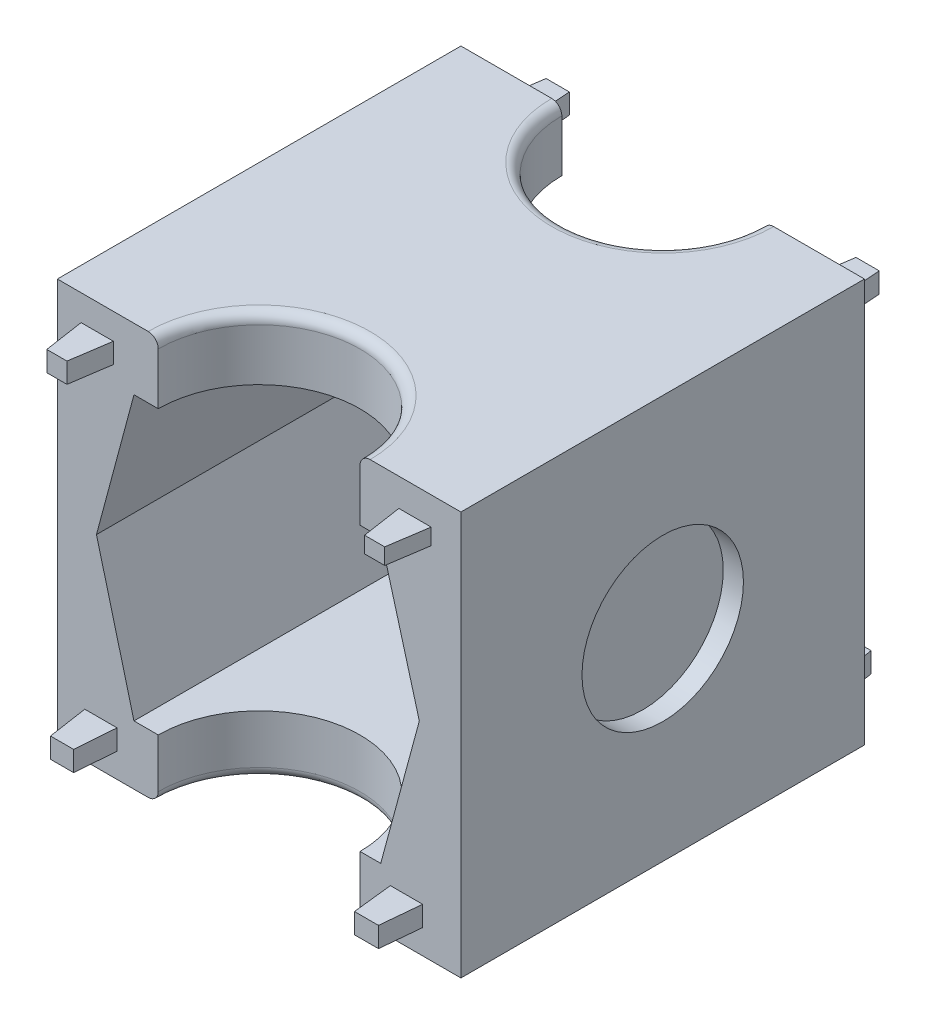
from build123d import *

# Parameters (mm, degrees)
SKETCH1_W               = 100
SKETCH1_H               = 100
BOSS_EXTRUDE1_DEPTH     = 100
SKETCH2_R               = 20
CUT_EXTRUDE1_DEPTH      = 5
CUT_EXTRUDE2_START      = -5
SKETCH3_R               = 20
CUT_EXTRUDE2_DEPTH      = 5
CUT_EXTRUDE3_DEPTH      = 151
CUT_EXTRUDE5_DEPTH      = 151
CUT_EXTRUDE5_DEPTH_BACK = 151
CUT_EXTRUDE6_DEPTH      = 151
CUT_EXTRUDE6_DEPTH_BACK = 151
FILLET3_R               = 2.5
BOSS_EXTRUDE3_DEPTH     = 10
CUT_EXTRUDE8_DEPTH      = 10
CUT_EXTRUDE9_DEPTH      = 10
BOSS_EXTRUDE4_DEPTH     = 10
CUT_EXTRUDE11_DEPTH     = 10
CUT_EXTRUDE12_DEPTH     = 10
BOSS_EXTRUDE5_DEPTH     = 10
CUT_EXTRUDE13_DEPTH     = 10
CUT_EXTRUDE15_DEPTH     = 10
BOSS_EXTRUDE6_DEPTH     = 10
CUT_EXTRUDE16_DEPTH     = 10
CUT_EXTRUDE17_DEPTH     = 10
BOSS_EXTRUDE7_DEPTH     = 10
CUT_EXTRUDE18_DEPTH     = 10
CUT_EXTRUDE19_DEPTH     = 10
BOSS_EXTRUDE8_DEPTH     = 10
CUT_EXTRUDE20_DEPTH     = 10
CUT_EXTRUDE21_DEPTH     = 10
BOSS_EXTRUDE9_DEPTH     = 10
CUT_EXTRUDE22_DEPTH     = 10
CUT_EXTRUDE23_DEPTH     = 10
BOSS_EXTRUDE10_DEPTH    = 10
CUT_EXTRUDE24_DEPTH     = 10
CUT_EXTRUDE25_DEPTH     = 10


with BuildPart() as part:
    # Sketch1 → Boss-Extrude1 (new body)
    with BuildSketch(Plane(origin=(0, 0, 0), x_dir=(0, 0, -1), z_dir=(1, 0, 0))):
        Rectangle(SKETCH1_W, SKETCH1_H)
    extrude(amount=BOSS_EXTRUDE1_DEPTH)

    # Sketch2 → Cut-Extrude1 (cut)
    with BuildSketch(Plane.ZY):
        Circle(SKETCH2_R)
    extrude(amount=-CUT_EXTRUDE1_DEPTH, mode=Mode.SUBTRACT)

    # Sketch3 → Cut-Extrude2 (cut)
    with BuildSketch(Plane(origin=(100, 0, 0), x_dir=(0, 0, -1), z_dir=(1, 0, 0)).offset(CUT_EXTRUDE2_START)):
        with Locations(Location((0, 0, 0), (0, 0, 180))):
            Circle(SKETCH3_R)
    extrude(amount=CUT_EXTRUDE2_DEPTH, mode=Mode.SUBTRACT)

    # Sketch4 → Cut-Extrude3 (cut, through all)
    with BuildSketch(Plane(origin=(0, 0, -50), x_dir=(-1, 0, 0), z_dir=(0, 0, -1))):
        Polygon((-80.128941466, 34.659382406), (-18.986632905, 34.659382406), (-9.691227462, 0), (-18.986632905, -35.340617594), (-80.128941466, -35.340617594), (-89.691227462, 0), align=None)
    extrude(amount=-CUT_EXTRUDE3_DEPTH, mode=Mode.SUBTRACT)

    # Sketch15 → Cut-Extrude5 (cut, two sides: drawn at the far end of the back side and taken through both)
    with BuildSketch(Plane(origin=(0, 50, 0), x_dir=(1, 0, 0), z_dir=(0, 1, 0)).offset(-CUT_EXTRUDE5_DEPTH_BACK)):
        with BuildLine():
            Line((75, -310), (75, -50))
            ThreePointArc((75, -50), (50, -25), (25, -50))
            Line((25, -50), (25, -310))
            Line((25, -310), (25, -830))
            Line((25, -830), (75, -830))
            Line((75, -830), (75, -310))
        make_face()
    extrude(amount=CUT_EXTRUDE5_DEPTH + CUT_EXTRUDE5_DEPTH_BACK, mode=Mode.SUBTRACT)

    # Sketch16 → Cut-Extrude6 (cut, two sides: drawn at the far end of the back side and taken through both)
    with BuildSketch(Plane(origin=(0, 50, 0), x_dir=(1, 0, 0), z_dir=(0, 1, 0)).offset(-CUT_EXTRUDE6_DEPTH_BACK)):
        with BuildLine():
            Line((25, 310), (25, 50))
            ThreePointArc((25, 50), (50, 25), (75, 50))
            Line((75, 50), (75, 310))
            Line((75, 310), (75, 830))
            Line((75, 830), (25, 830))
            Line((25, 830), (25, 310))
        make_face()
    extrude(amount=CUT_EXTRUDE6_DEPTH + CUT_EXTRUDE6_DEPTH_BACK, mode=Mode.SUBTRACT)

    # Fillet3
    fillet3_edges = [part.edges().sort_by_distance(p)[0] for p in [
        (50, -50, 25),
        (50, 50, 25),
        (50, -50, -25),
        (50, 50, -25),
    ]]
    fillet(fillet3_edges, radius=FILLET3_R)

    # Sketch17 → Boss-Extrude3 (add)
    with BuildSketch(Plane.XY.offset(50)):
        with BuildLine():
            Line((84.621199284, 43.079691203), (92.621199284, 43.079691203))
            ThreePointArc((92.621199284, 43.079691203), (94.621199284, 41.079691203), (92.621199284, 39.079691203))
            Line((92.621199284, 39.079691203), (84.621199284, 39.079691203))
            ThreePointArc((84.621199284, 39.079691203), (82.621199284, 41.079691203), (84.621199284, 43.079691203))
        make_face()
    extrude(amount=BOSS_EXTRUDE3_DEPTH)

    # Sketch18 → Cut-Extrude8 (cut)
    with BuildSketch(Plane(origin=(0, 43.079691203, 0), x_dir=(1, 0, 0), z_dir=(0, 1, 0))):
        Polygon((84.621199284, -50), (86.121199284, -60), (82.621199284, -60), (82.621199284, -50), align=None)
    extrude(amount=-CUT_EXTRUDE8_DEPTH, mode=Mode.SUBTRACT)

    # Sketch20 → Cut-Extrude9 (cut)
    with BuildSketch(Plane(origin=(0, 43.079691203, 0), x_dir=(1, 0, 0), z_dir=(0, 1, 0))):
        Polygon((91.121199284, -60), (94.621199284, -60), (94.621199284, -50), (92.621199284, -50), align=None)
    extrude(amount=-CUT_EXTRUDE9_DEPTH, mode=Mode.SUBTRACT)

    # Sketch24 → Boss-Extrude4 (add)
    with BuildSketch(Plane.XY.offset(50)):
        with BuildLine():
            Line((5.882221412, 43.579691203), (13.882221412, 43.579691203))
            ThreePointArc((13.882221412, 43.579691203), (16.382221412, 41.079691203), (13.882221412, 38.579691203))
            Line((13.882221412, 38.579691203), (5.882221412, 38.579691203))
            ThreePointArc((5.882221412, 38.579691203), (3.382221412, 41.079691203), (5.882221412, 43.579691203))
        make_face()
    extrude(amount=BOSS_EXTRUDE4_DEPTH)

    # Sketch25 → Cut-Extrude11 (cut)
    with BuildSketch(Plane(origin=(0, 43.579691203, 0), x_dir=(1, 0, 0), z_dir=(0, 1, 0))):
        Polygon((3.382221412, -50), (5.882221412, -50), (7.382221412, -60), (3.382221412, -60), align=None)
    extrude(amount=-CUT_EXTRUDE11_DEPTH, mode=Mode.SUBTRACT)

    # Sketch26 → Cut-Extrude12 (cut)
    with BuildSketch(Plane(origin=(0, 43.579691203, 0), x_dir=(1, 0, 0), z_dir=(0, 1, 0))):
        Polygon((12.382221412, -60), (13.882221412, -50), (16.382221412, -50), (16.382221412, -60), align=None)
    extrude(amount=-CUT_EXTRUDE12_DEPTH, mode=Mode.SUBTRACT)

    # Sketch27 → Boss-Extrude5 (add)
    with BuildSketch(Plane.XY.offset(50)):
        with BuildLine():
            Line((6.7978639, -43.920308797), (14.7978639, -43.920308797))
            ThreePointArc((14.7978639, -43.920308797), (17.2978639, -41.420308797), (14.7978639, -38.920308797))
            Line((14.7978639, -38.920308797), (6.7978639, -38.920308797))
            ThreePointArc((6.7978639, -38.920308797), (4.2978639, -41.420308797), (6.7978639, -43.920308797))
        make_face()
    extrude(amount=BOSS_EXTRUDE5_DEPTH)

    # Sketch29 → Cut-Extrude13 (cut)
    with BuildSketch(Plane.XZ.offset(43.920308797)):
        Polygon((8.2978639, 60), (6.7978639, 50), (4.2978639, 50), (4.2978639, 60), align=None)
    extrude(amount=-CUT_EXTRUDE13_DEPTH, mode=Mode.SUBTRACT)

    # Sketch30 → Cut-Extrude15 (cut)
    with BuildSketch(Plane.XZ.offset(43.920308797)):
        Polygon((14.0478639, 60), (17.2978639, 60), (17.2978639, 50), (14.7978639, 50), align=None)
    extrude(amount=-CUT_EXTRUDE15_DEPTH, mode=Mode.SUBTRACT)

    # Sketch31 → Boss-Extrude6 (add)
    with BuildSketch(Plane.XY.offset(50)):
        with BuildLine():
            Line((82.517325635, -38.920308797), (90.517325635, -38.920308797))
            ThreePointArc((90.517325635, -38.920308797), (93.017325635, -41.420308797), (90.517325635, -43.920308797))
            Line((90.517325635, -43.920308797), (82.517325635, -43.920308797))
            ThreePointArc((82.517325635, -43.920308797), (80.017325635, -41.420308797), (82.517325635, -38.920308797))
        make_face()
    extrude(amount=BOSS_EXTRUDE6_DEPTH)

    # Sketch33 → Cut-Extrude16 (cut)
    with BuildSketch(Plane.XZ.offset(43.920308797)):
        Polygon((83.621199284, 60), (82.517325635, 50), (80.017325635, 50), (80.017325635, 60), align=None)
    extrude(amount=-CUT_EXTRUDE16_DEPTH, mode=Mode.SUBTRACT)

    # Sketch34 → Cut-Extrude17 (cut)
    with BuildSketch(Plane.XZ.offset(43.920308797)):
        Polygon((89.56926246, 60), (90.517325635, 50), (93.017325635, 50), (93.017325635, 60), align=None)
    extrude(amount=-CUT_EXTRUDE17_DEPTH, mode=Mode.SUBTRACT)

    # Sketch35 → Boss-Extrude7 (add)
    with BuildSketch(Plane(origin=(0, 0, -50), x_dir=(-1, 0, 0), z_dir=(0, 0, -1))):
        with BuildLine():
            Line((-17.608468635, 43.579691203), (-9.608468635, 43.579691203))
            ThreePointArc((-9.608468635, 43.579691203), (-7.108468635, 41.079691203), (-9.608468635, 38.579691203))
            Line((-9.608468635, 38.579691203), (-17.608468635, 38.579691203))
            ThreePointArc((-17.608468635, 38.579691203), (-20.108468635, 41.079691203), (-17.608468635, 43.579691203))
        make_face()
    extrude(amount=BOSS_EXTRUDE7_DEPTH)

    # Sketch36 → Cut-Extrude18 (cut)
    with BuildSketch(Plane(origin=(0, 43.579691203, 0), x_dir=(1, 0, 0), z_dir=(0, 1, 0))):
        Polygon((11.108468635, 60), (9.608468635, 50), (7.108468635, 50), (7.108468635, 60), align=None)
    extrude(amount=-CUT_EXTRUDE18_DEPTH, mode=Mode.SUBTRACT)

    # Sketch37 → Cut-Extrude19 (cut)
    with BuildSketch(Plane(origin=(0, 43.579691203, 0), x_dir=(1, 0, 0), z_dir=(0, 1, 0))):
        Polygon((16.858468635, 60), (17.608468635, 50), (20.108468635, 50), (20.108468635, 60), align=None)
    extrude(amount=-CUT_EXTRUDE19_DEPTH, mode=Mode.SUBTRACT)

    # Sketch38 → Boss-Extrude8 (add)
    with BuildSketch(Plane(origin=(0, 0, -50), x_dir=(-1, 0, 0), z_dir=(0, 0, -1))):
        with BuildLine():
            Line((-17.330505729, -38.920308797), (-9.330505729, -38.920308797))
            ThreePointArc((-9.330505729, -38.920308797), (-6.830505729, -41.420308797), (-9.330505729, -43.920308797))
            Line((-9.330505729, -43.920308797), (-17.330505729, -43.920308797))
            ThreePointArc((-17.330505729, -43.920308797), (-19.830505729, -41.420308797), (-17.330505729, -38.920308797))
        make_face()
    extrude(amount=BOSS_EXTRUDE8_DEPTH)

    # Sketch40 → Cut-Extrude20 (cut)
    with BuildSketch(Plane.XZ.offset(43.920308797)):
        Polygon((10.830505729, -60), (9.330505729, -50), (6.830505729, -50), (6.830505729, -60), align=None)
    extrude(amount=-CUT_EXTRUDE20_DEPTH, mode=Mode.SUBTRACT)

    # Sketch41 → Cut-Extrude21 (cut)
    with BuildSketch(Plane.XZ.offset(43.920308797)):
        Polygon((16.580505729, -60), (17.330505729, -50), (19.830505729, -50), (19.830505729, -60), align=None)
    extrude(amount=-CUT_EXTRUDE21_DEPTH, mode=Mode.SUBTRACT)

    # Sketch42 → Boss-Extrude9 (add)
    with BuildSketch(Plane(origin=(0, 0, -50), x_dir=(-1, 0, 0), z_dir=(0, 0, -1))):
        with BuildLine():
            Line((-94.397005035, 43.579691203), (-86.397005035, 43.579691203))
            ThreePointArc((-86.397005035, 43.579691203), (-83.897005035, 41.079691203), (-86.397005035, 38.579691203))
            Line((-86.397005035, 38.579691203), (-94.397005035, 38.579691203))
            ThreePointArc((-94.397005035, 38.579691203), (-96.897005035, 41.079691203), (-94.397005035, 43.579691203))
        make_face()
    extrude(amount=BOSS_EXTRUDE9_DEPTH)

    # Sketch43 → Cut-Extrude22 (cut)
    with BuildSketch(Plane(origin=(0, 43.579691203, 0), x_dir=(1, 0, 0), z_dir=(0, 1, 0))):
        Polygon((87.897005035, 60), (86.397005035, 50), (83.897005035, 50), (83.897005035, 60), align=None)
    extrude(amount=-CUT_EXTRUDE22_DEPTH, mode=Mode.SUBTRACT)

    # Sketch44 → Cut-Extrude23 (cut)
    with BuildSketch(Plane(origin=(0, 43.579691203, 0), x_dir=(1, 0, 0), z_dir=(0, 1, 0))):
        Polygon((93.647005035, 60), (94.397005035, 50), (96.897005035, 50), (96.897005035, 60), align=None)
    extrude(amount=-CUT_EXTRUDE23_DEPTH, mode=Mode.SUBTRACT)

    # Sketch45 → Boss-Extrude10 (add)
    with BuildSketch(Plane(origin=(0, 0, -50), x_dir=(-1, 0, 0), z_dir=(0, 0, -1))):
        with BuildLine():
            Line((-93.140486024, -38.920308797), (-85.140486024, -38.920308797))
            ThreePointArc((-85.140486024, -38.920308797), (-82.640486024, -41.420308797), (-85.140486024, -43.920308797))
            Line((-85.140486024, -43.920308797), (-93.140486024, -43.920308797))
            ThreePointArc((-93.140486024, -43.920308797), (-95.640486024, -41.420308797), (-93.140486024, -38.920308797))
        make_face()
    extrude(amount=BOSS_EXTRUDE10_DEPTH)

    # Sketch47 → Cut-Extrude24 (cut)
    with BuildSketch(Plane.XZ.offset(43.920308797)):
        Polygon((86.640486024, -60), (85.140486024, -50), (82.640486024, -50), (82.640486024, -60), align=None)
    extrude(amount=-CUT_EXTRUDE24_DEPTH, mode=Mode.SUBTRACT)

    # Sketch48 → Cut-Extrude25 (cut)
    with BuildSketch(Plane.XZ.offset(43.920308797)):
        Polygon((91.647943496, -60), (93.140486024, -50), (95.640486024, -50), (95.640486024, -60), align=None)
    extrude(amount=-CUT_EXTRUDE25_DEPTH, mode=Mode.SUBTRACT)


solid = part.part
